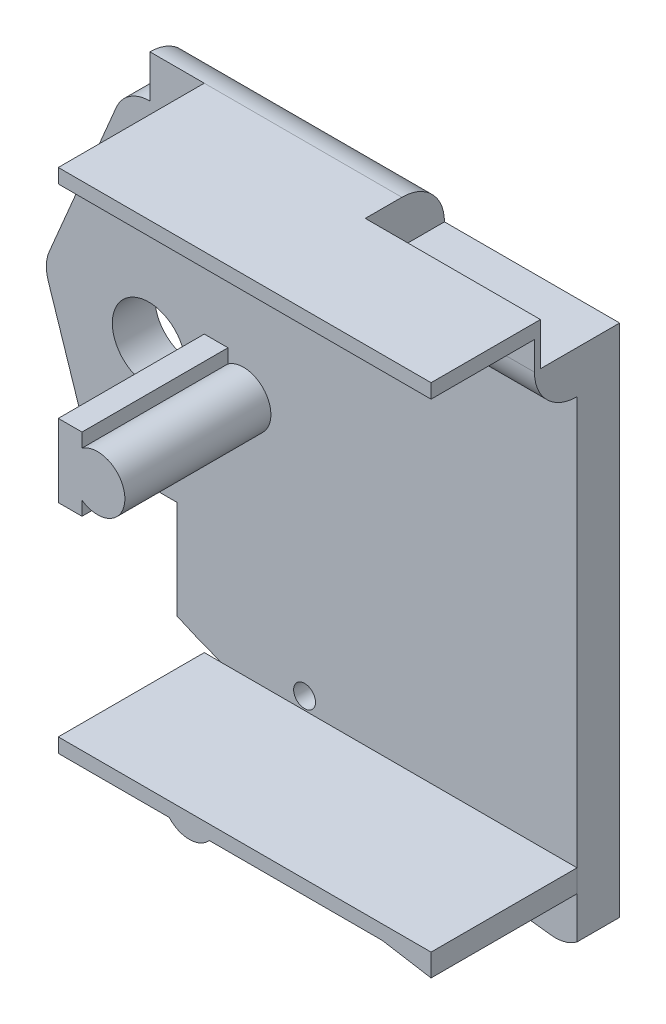
from build123d import *

# Parameters (mm, degrees)
EXTRUDE_1_DEPTH     = 40
EXTRUDE_1_2_DEPTH   = 40
EXTRUDE_1_3_DEPTH   = 40
SKETCH_2_R          = 3
EXTRUDE_2_DEPTH     = 13
EXTRUDE_3_DEPTH     = 148.86088
EXTRUDE_4_DEPTH     = 55
SKETCH_6_W          = 23.030106463
SKETCH_6_H          = 11.671315475
CUT_EXTRUDE_1_DEPTH = 52
SKETCH_7_W          = 1.171392603
SKETCH_7_H          = 3.916398917
CUT_EXTRUDE_2_DEPTH = 52
SKETCH_8_W          = 1.171392603
SKETCH_8_H          = 7.044464959
CUT_EXTRUDE_3_DEPTH = 52
CUT_EXTRUDE_4_DEPTH = 40
SKETCH_11_W         = 1.328684526
SKETCH_11_H         = 148.506593242
CUT_EXTRUDE_5_DEPTH = 160
SKETCH_12_W         = 4
SKETCH_12_H         = 162.281264585
CUT_EXTRUDE_6_DEPTH = 160
SKETCH_13_R         = 10
CUT_EXTRUDE_8_DEPTH = 32
SKETCH_14_W         = 27.828077966
SKETCH_14_H         = 11.671315475
CUT_EXTRUDE_9_DEPTH = 18


with BuildPart() as part:
    # Эскиз3 → Бобышка-Вытянуть1 (new body)
    with BuildSketch(Plane(origin=(0, 0, 53), x_dir=(-1, 0, 0), z_dir=(0, 0, 1))):
        Polygon((54.875373692, -65.599681844), (54.875373692, -69.516080761), (204.631843366, -69.516080761), (204.907646106, -65.599681844), align=None)
    extrude(amount=-EXTRUDE_1_DEPTH)



with BuildPart() as body_2:
    # Эскиз3 → Extrude 1 2 (new body)
    with BuildSketch(Plane(origin=(0, 0, 53), x_dir=(-1, 0, 0), z_dir=(0, 0, 1))):
        with BuildLine():
            Line((54.875373692, 72.608931758), (54.875373692, 65.599681844))
            Line((54.875373692, 65.599681844), (133.584399888, 65.599681844))
            Line((133.584399888, 65.599681844), (204.907646106, 65.599681844))
            Line((204.907646106, 65.599681844), (204.631843366, 69.516080761))
            Line((204.631843366, 69.516080761), (131.796304317, 69.516080761))
            ThreePointArc((131.796304317, 69.516080761), (126.303865044, 71.985274815), (120.811425771, 69.516080761))
            Line((120.811425771, 69.516080761), (73.432479677, 69.516080761))
            Line((73.432479677, 69.516080761), (54.875373692, 72.608931758))
        make_face()
    extrude(amount=-EXTRUDE_1_2_DEPTH)

    # Эскиз8 → Вырез-Вытянуть3 (cut)
    with BuildSketch(Plane(origin=(0, 0, 13), x_dir=(-1, 0, 0), z_dir=(0, 0, -1))):
        with Locations((55.461069994, -69.121914323)):
            Rectangle(SKETCH_8_W, SKETCH_8_H)
    extrude(amount=-CUT_EXTRUDE_3_DEPTH, mode=Mode.SUBTRACT)


with BuildPart() as body_3:
    # Эскиз3 → Extrude 1 3 (new body)
    with BuildSketch(Plane(origin=(0, 0, 53), x_dir=(-1, 0, 0), z_dir=(0, 0, 1))):
        with BuildLine():
            Line((155.687413664, 10.016575084), (162.186830452, 10.016575084))
            Line((162.186830452, 10.016575084), (162.186830452, -9.983424916))
            Line((162.186830452, -9.983424916), (155.687413664, -9.983424916))
            Line((155.687413664, -9.983424916), (155.687413664, -6.162827902))
            ThreePointArc((155.687413664, -6.162827902), (143.937122058, 0.016575084), (155.687413664, 6.19597807))
            Line((155.687413664, 6.19597807), (155.687413664, 10.016575084))
        make_face()
    extrude(amount=-EXTRUDE_1_3_DEPTH)


with BuildPart() as body_4:
    # Эскиз2 → Бобышка-Вытянуть2 (new body)
    with BuildSketch(Plane.XY):
        with BuildLine():
            Line((-56.046766295, 57.844765286), (-56.046766295, -75.195150142))
            ThreePointArc((-56.046766295, -75.195150142), (-59.367136966, -82.637095589), (-67.123276701, -85.137037556))
            add(Edge.make_bspline(
                [(-169.706213848, -60.635244362), (-159.663451251, -65.329375592), (-148.333852624, -68.807240721), (-114.322706555, -77.808926564), (-90.368141829, -82.620076926), (-67.123276701, -85.137037556)],
                knots=[0.055135266, 0.055135266, 0.055135266, 0.055135266, 0.172676281, 0.181905401, 0.42983809, 0.42983809, 0.42983809, 0.42983809], degree=3))
            Line((-169.706213848, -60.635244362), (-169.706213848, -33.694561876))
            Line((-169.706213848, -33.694561876), (-193.502816731, -33.694561876))
            Line((-193.502816731, -33.694561876), (-204.96911778, 1.281363609))
            ThreePointArc((-204.96911778, 1.281363609), (-205.458000207, 4.814198713), (-204.675999382, 8.293912006))
            Line((-204.675999382, 8.293912006), (-186.288842912, 51.742105172))
            ThreePointArc((-186.288842912, 51.742105172), (-182.603452695, 56.180633533), (-177.07956814, 57.844765286))
            Line((-177.07956814, 57.844765286), (-56.046766295, 57.844765286))
        make_face()
        with Locations(Location((-134.706213848, -62.155234714, 0), (0, 0, 180))):
            Circle(SKETCH_2_R, mode=Mode.SUBTRACT)
    extrude(amount=EXTRUDE_2_DEPTH)


with BuildPart() as part_1:
    add(part.part)

    add(body_4.part)  # Бобышка-Вытянуть3 merges body 4
    # Эскиз4 → Бобышка-Вытянуть3 (add)
    with BuildSketch(Plane(origin=(-56.046766295, 0, 0), x_dir=(0, 0, -1), z_dir=(1, 0, 0))):
        with BuildLine():
            Line((-21.7224351, 65.599681844), (-13, 65.599681844))
            Line((-13, 65.599681844), (-13, 57.844765286))
            Line((-13, 57.844765286), (-1.328684526, 57.844765286))
            ThreePointArc((-1.328684526, 57.844765286), (-8.851668218, 68.753979205), (-21.7224351, 65.599681844))
        make_face()
    extrude(amount=-EXTRUDE_3_DEPTH)

    # Эскиз5 → Бобышка-Вытянуть4 (add)
    with BuildSketch(Plane(origin=(-56.046766295, 0, 0), x_dir=(0, 0, -1), z_dir=(1, 0, 0))):
        with BuildLine():
            Line((-13, 69.516080761), (-24.671315474, 69.516080761))
            Line((-24.671315474, 69.516080761), (-24.671315474, 57.844765286))
            ThreePointArc((-24.671315474, 57.844765286), (-4.747133683, 49.591898969), (-13, 69.516080761))
        make_face()
    extrude(amount=-EXTRUDE_4_DEPTH)

    # Эскиз6 → Вырез-Вытянуть1 (cut)
    with BuildSketch(Plane(origin=(-56.046766295, 0, 0), x_dir=(0, 0, -1), z_dir=(1, 0, 0))):
        with Locations((-11.515053232, 63.680423023)):
            Rectangle(SKETCH_6_W, SKETCH_6_H)
    extrude(amount=-CUT_EXTRUDE_1_DEPTH, mode=Mode.SUBTRACT)

    # Эскиз7 → Вырез-Вытянуть2 (cut)
    with BuildSketch(Plane(origin=(0, 0, 13), x_dir=(-1, 0, 0), z_dir=(0, 0, -1))):
        with Locations((55.461069994, 67.557881302)):
            Rectangle(SKETCH_7_W, SKETCH_7_H)
    extrude(amount=-CUT_EXTRUDE_2_DEPTH, mode=Mode.SUBTRACT)


with BuildPart() as cut_extrude_4_tool:
    # Эскиз9 → Вырез-Вытянуть4 (new body)
    with BuildSketch(Plane.XY.offset(53)):
        Polygon((-162.186830452, 9.812396247), (-162.186830452, 78.38916829), (-213.765652488, 78.38916829), (-213.765652488, -81.254607488), (-162.186830452, -81.254607488), align=None)
    extrude(amount=-CUT_EXTRUDE_4_DEPTH)


with BuildPart() as part_2:
    add(part_1.part)

    # Вырез-Вытянуть4: cut by cut_extrude_4_tool
    add(cut_extrude_4_tool.part, mode=Mode.SUBTRACT)

    # Эскиз11 → Вырез-Вытянуть5 (cut)
    with BuildSketch(Plane(origin=(-56.046766295, 0, 0), x_dir=(0, 0, -1), z_dir=(1, 0, 0))):
        with Locations((-0.664342263, -16.408531335)):
            Rectangle(SKETCH_11_W, SKETCH_11_H)
    extrude(amount=-CUT_EXTRUDE_5_DEPTH, mode=Mode.SUBTRACT)


with BuildPart() as body_2_1:
    add(body_2.part)

    # Вырез-Вытянуть4: cut by cut_extrude_4_tool
    add(cut_extrude_4_tool.part, mode=Mode.SUBTRACT)


with BuildPart() as cut_extrude_6_tool:
    # Эскиз12 → Вырез-Вытянуть6 (new body)
    with BuildSketch(Plane(origin=(0, 0, 1.328684526), x_dir=(-1, 0, 0), z_dir=(0, 0, -1))):
        with Locations((58.046766295, -11.624551532)):
            Rectangle(SKETCH_12_W, SKETCH_12_H)
    extrude(amount=-CUT_EXTRUDE_6_DEPTH)


with BuildPart() as part_3:
    add(part_2.part)

    # Вырез-Вытянуть6: cut by cut_extrude_6_tool
    add(cut_extrude_6_tool.part, mode=Mode.SUBTRACT)

    # Эскиз13 → Вырез-Вытянуть8 (cut)
    with BuildSketch(Plane(origin=(0, 0, 1.328684526), x_dir=(-1, 0, 0), z_dir=(0, 0, -1))):
        with Locations((177.385777156, -0.005707992)):
            Circle(SKETCH_13_R)
    extrude(amount=-CUT_EXTRUDE_8_DEPTH, mode=Mode.SUBTRACT)

    # Эскиз14 → Вырез-Вытянуть9 (cut)
    with BuildSketch(Plane.XY.offset(13)):
        with Locations((-190.993607123, 63.680423023)):
            Rectangle(SKETCH_14_W, SKETCH_14_H)
    extrude(amount=-CUT_EXTRUDE_9_DEPTH, mode=Mode.SUBTRACT)


with BuildPart() as body_2_2:
    add(body_2_1.part)

    # Вырез-Вытянуть6: cut by cut_extrude_6_tool
    add(cut_extrude_6_tool.part, mode=Mode.SUBTRACT)


solid = Compound([body_3.part, part_3.part, body_2_2.part])
